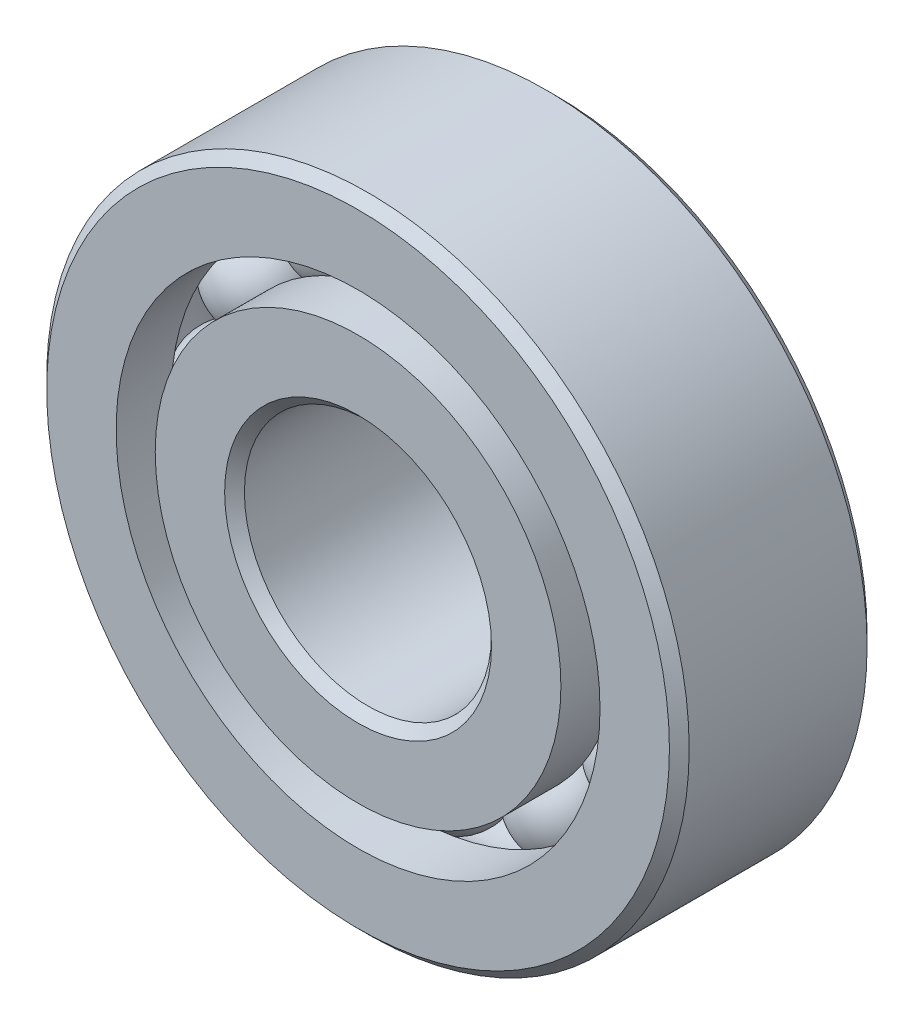
from build123d import *

# Parameters (mm, degrees)
CIRPATTERN1_COUNT = 12


with BuildPart() as part:
    # Sketch1 → Revolve1 (revolve)
    with BuildSketch(Plane(origin=(0, 0, 0), x_dir=(0, 0, -1), z_dir=(1, 0, 0)), mode=Mode.PRIVATE) as revolve1_sk:
        with BuildLine():
            Line((3.6, 13), (-3.6, 13))
            Line((-3.6, 13), (-4, 12.6))
            Line((-4, 12.6), (-4, 9.791208791))
            Line((-4, 9.791208791), (-1.777777778, 9.791208791))
            ThreePointArc((-1.777777778, 9.791208791), (0, 10.945894442), (1.777777778, 9.791208791))
            Line((1.777777778, 9.791208791), (4, 9.791208791))
            Line((4, 9.791208791), (4, 12.6))
            Line((4, 12.6), (3.6, 13))
        make_face()
    revolve(revolve1_sk.sketch.rotate(Axis((0, 0, 4), (0, 0, -1)), 90), axis=Axis((0, 0, 4), (0, 0, -1)))


with BuildPart() as body_2:
    # Sketch3 → Revolve3 (revolve)
    with BuildSketch(Plane(origin=(0, 0, 0), x_dir=(0, 0, -1), z_dir=(1, 0, 0)), mode=Mode.PRIVATE) as revolve3_sk:
        with BuildLine():
            Line((-4, 8.208791209), (-1.777777778, 8.208791209))
            ThreePointArc((-1.777777778, 8.208791209), (0, 7.054105558), (1.777777778, 8.208791209))
            Line((1.777777778, 8.208791209), (4, 8.208791209))
            Line((4, 8.208791209), (4, 5.4))
            Line((4, 5.4), (3.6, 5))
            Line((3.6, 5), (-3.6, 5))
            Line((-3.6, 5), (-4, 5.4))
            Line((-4, 5.4), (-4, 8.208791209))
        make_face()
    revolve(revolve3_sk.sketch.rotate(Axis((0, 0, 4), (0, 0, -1)), 90), axis=Axis((0, 0, 4), (0, 0, -1)))


with BuildPart() as body_3:
    # Sketch4 → Revolve4 (revolve)
    with BuildSketch(Plane(origin=(0, 0, 0), x_dir=(0, 0, -1), z_dir=(1, 0, 0))):
        with BuildLine():
            Line((-1.945894442, 9), (1.945894442, 9))
            ThreePointArc((1.945894442, 9), (0, 10.945894442), (-1.945894442, 9))
        make_face()
    revolve(axis=Axis((0, 9, 1.945894442), (0, 0, -1)))


with BuildPart() as cirpattern1_1:
    # CirPattern1: pattern copy
    add(body_3.part.rotate(Axis((0, 0, 0), (0, 0, 1)), 1 * 360 / CIRPATTERN1_COUNT))


with BuildPart() as cirpattern1_2:
    # CirPattern1: pattern copy
    add(body_3.part.rotate(Axis((0, 0, 0), (0, 0, 1)), 2 * 360 / CIRPATTERN1_COUNT))


with BuildPart() as cirpattern1_3:
    # CirPattern1: pattern copy
    add(body_3.part.rotate(Axis((0, 0, 0), (0, 0, 1)), 3 * 360 / CIRPATTERN1_COUNT))


with BuildPart() as cirpattern1_4:
    # CirPattern1: pattern copy
    add(body_3.part.rotate(Axis((0, 0, 0), (0, 0, 1)), 4 * 360 / CIRPATTERN1_COUNT))


with BuildPart() as cirpattern1_5:
    # CirPattern1: pattern copy
    add(body_3.part.rotate(Axis((0, 0, 0), (0, 0, 1)), 5 * 360 / CIRPATTERN1_COUNT))


with BuildPart() as cirpattern1_6:
    # CirPattern1: pattern copy
    add(body_3.part.rotate(Axis((0, 0, 0), (0, 0, 1)), 6 * 360 / CIRPATTERN1_COUNT))


with BuildPart() as cirpattern1_7:
    # CirPattern1: pattern copy
    add(body_3.part.rotate(Axis((0, 0, 0), (0, 0, 1)), 7 * 360 / CIRPATTERN1_COUNT))


with BuildPart() as cirpattern1_8:
    # CirPattern1: pattern copy
    add(body_3.part.rotate(Axis((0, 0, 0), (0, 0, 1)), 8 * 360 / CIRPATTERN1_COUNT))


with BuildPart() as cirpattern1_9:
    # CirPattern1: pattern copy
    add(body_3.part.rotate(Axis((0, 0, 0), (0, 0, 1)), 9 * 360 / CIRPATTERN1_COUNT))


with BuildPart() as cirpattern1_10:
    # CirPattern1: pattern copy
    add(body_3.part.rotate(Axis((0, 0, 0), (0, 0, 1)), 10 * 360 / CIRPATTERN1_COUNT))


with BuildPart() as cirpattern1_11:
    # CirPattern1: pattern copy
    add(body_3.part.rotate(Axis((0, 0, 0), (0, 0, 1)), 11 * 360 / CIRPATTERN1_COUNT))


solid = Compound([part.part, body_2.part, body_3.part, cirpattern1_1.part, cirpattern1_2.part, cirpattern1_3.part, cirpattern1_4.part, cirpattern1_5.part, cirpattern1_6.part, cirpattern1_7.part, cirpattern1_8.part, cirpattern1_9.part, cirpattern1_10.part, cirpattern1_11.part])
